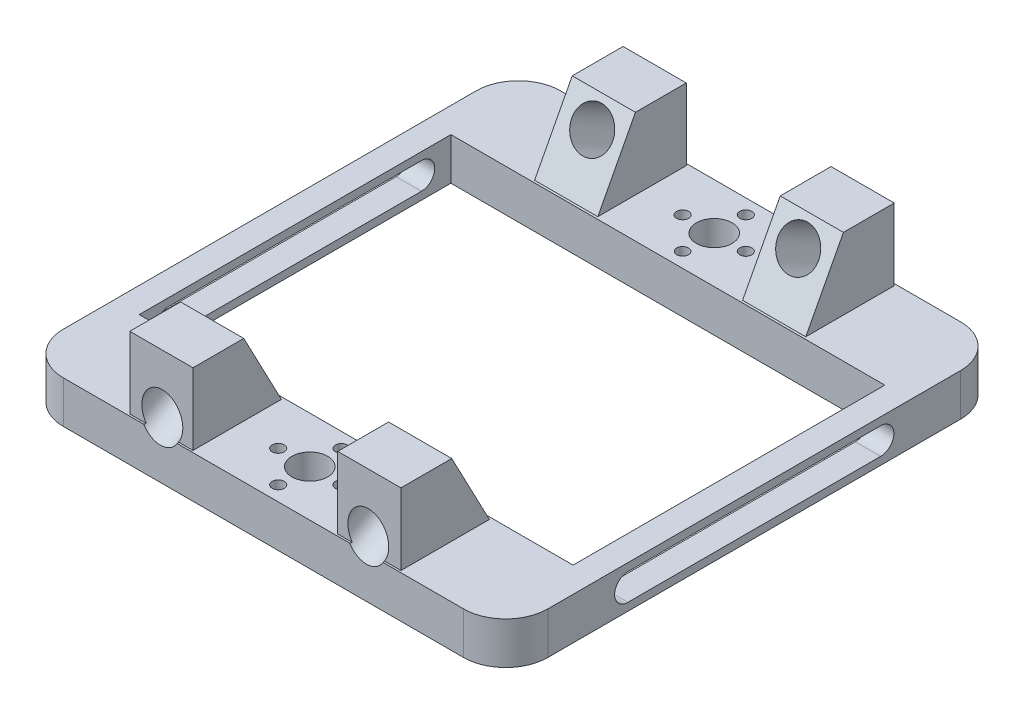
from build123d import *

# Parameters (mm, degrees)
SKETCH2_W               = 115
SKETCH2_H               = 22
SKETCH2_R               = 4.25
BOSS_EXTRUDE1_DEPTH     = 10
BOSS_EXTRUDE1_2_DEPTH   = 10
SKETCH3_R               = 1.4
SKETCH3_R_2             = 1.44
CUT_EXTRUDE3_DEPTH      = 83.989457162
FILLET1_R               = 10
FILLET2_R               = 10
SKETCH5_W               = 6
SKETCH5_H               = 10
BOSS_EXTRUDE2_DEPTH     = 74
CUT_EXTRUDE4_DEPTH      = 125.346290656
CUT_EXTRUDE4_DEPTH_BACK = 125.346290656
SKETCH7_W               = 15
SKETCH7_H               = 21
BOSS_EXTRUDE3_DEPTH     = 17
CUT_EXTRUDE5_DEPTH      = 99.933743619
SKETCH9_R               = 4.85
CUT_EXTRUDE6_DEPTH      = 110.718166224
MIRROR5_COPY_1_SKETCH_W = 15
MIRROR5_COPY_1_SKETCH_H = 21
MIRROR5_COPY_1_DEPTH    = 17
MIRROR5_COPY_2_DEPTH    = 99.933743619
MIRROR5_COPY_3_SKETCH_R = 4.85
MIRROR5_COPY_3_DEPTH    = 110.718166224


with BuildPart() as part:
    # Sketch2 → Boss-Extrude1 (new body)
    with BuildSketch(Plane(origin=(0, 0, 0), x_dir=(1, 0, 0), z_dir=(0, 1, 0))):
        with Locations((0, -48)):
            Rectangle(SKETCH2_W, SKETCH2_H)
        with Locations(Location((0, -48, 0), (0, 0, 270))):
            Circle(SKETCH2_R, mode=Mode.SUBTRACT)
    extrude(amount=BOSS_EXTRUDE1_DEPTH)


with BuildPart() as body_2:
    # Sketch2 → Boss-Extrude1 2 (new body)
    with BuildSketch(Plane(origin=(0, 0, 0), x_dir=(1, 0, 0), z_dir=(0, 1, 0))):
        with Locations((0, 48)):
            Rectangle(SKETCH2_W, SKETCH2_H)
        with Locations(Location((0, 48, 0), (0, 0, 270))):
            Circle(SKETCH2_R, mode=Mode.SUBTRACT)
    extrude(amount=BOSS_EXTRUDE1_2_DEPTH)


with BuildPart() as cut_extrude3_tool:
    # Sketch3 → Cut-Extrude3 (new, through all)
    with BuildSketch(Plane(origin=(0, 10, 0), x_dir=(1, 0, 0), z_dir=(0, 1, 0))):
        with Locations(Location((0, -40.5, 0), (0, 0, 270))):
            Circle(SKETCH3_R)
        with Locations(Location((0, -55.5, 0), (0, 0, 270))):
            Circle(SKETCH3_R_2)
        with Locations(Location((7.5, -48, 0), (0, 0, 270))):
            Circle(SKETCH3_R_2)
        with Locations(Location((-7.5, -48, 0), (0, 0, 270))):
            Circle(SKETCH3_R_2)
        with Locations(Location((-7.5, 48, 0), (0, 0, 90))):
            Circle(SKETCH3_R_2)
        with Locations(Location((7.5, 48, 0), (0, 0, 90))):
            Circle(SKETCH3_R_2)
        with Locations(Location((0, 55.5, 0), (0, 0, 90))):
            Circle(SKETCH3_R_2)
        with Locations(Location((0, 40.5, 0), (0, 0, 90))):
            Circle(SKETCH3_R)
    extrude(amount=-CUT_EXTRUDE3_DEPTH)


with BuildPart() as part_1:
    add(part.part)

    # Cut-Extrude3: cut by cut_extrude3_tool
    add(cut_extrude3_tool.part, mode=Mode.SUBTRACT)

    # Fillet2
    fillet2_edges = [part_1.edges().sort_by_distance(p)[0] for p in [
        (57.5, 5, 59),
        (-57.5, 5, 59),
    ]]
    fillet(fillet2_edges, radius=FILLET2_R)



with BuildPart() as body_2_1:
    add(body_2.part)

    # Cut-Extrude3: cut by cut_extrude3_tool
    add(cut_extrude3_tool.part, mode=Mode.SUBTRACT)

    # Fillet1
    fillet1_edges = [body_2_1.edges().sort_by_distance(p)[0] for p in [
        (-57.5, 5, -59),
        (57.5, 5, -59),
    ]]
    fillet(fillet1_edges, radius=FILLET1_R)


with BuildPart() as part_2:
    add(part_1.part)

    add(body_2_1.part)  # Boss-Extrude2 merges body 2
    # Sketch5 → Boss-Extrude2 (add)
    with BuildSketch(Plane(origin=(0, 0, 37), x_dir=(-1, 0, 0), z_dir=(0, 0, -1))):
        with Locations((-54.5, 5)):
            Rectangle(SKETCH5_W, SKETCH5_H)
    boss_extrude2 = extrude(amount=BOSS_EXTRUDE2_DEPTH)

    # Mirror3: Boss-Extrude2 across plane
    add(boss_extrude2.mirror(Plane(origin=(0, 0, 0), x_dir=(0, 0, 1), z_dir=(1, 0, 0))))

    # Sketch6 → Cut-Extrude4 (cut, two sides: drawn at the far end of the back side and taken through both)
    with BuildSketch(Plane(origin=(-51.5, 0, 0), x_dir=(0, 0, -1), z_dir=(1, 0, 0)).offset(-CUT_EXTRUDE4_DEPTH_BACK)):
        with BuildLine():
            Line((-30, 8.15), (30, 8.15))
            ThreePointArc((30, 8.15), (33.15, 5), (30, 1.85))
            Line((30, 1.85), (-30, 1.85))
            ThreePointArc((-30, 1.85), (-33.15, 5), (-30, 8.15))
        make_face()
    extrude(amount=CUT_EXTRUDE4_DEPTH + CUT_EXTRUDE4_DEPTH_BACK, mode=Mode.SUBTRACT)

    # Sketch7 → Boss-Extrude3 (add)
    with BuildSketch(Plane(origin=(0, 10, 0), x_dir=(1, 0, 0), z_dir=(0, 1, 0))):
        with Locations((-24.685243699, -48.050972885)):
            Rectangle(SKETCH7_W, SKETCH7_H)
    boss_extrude3 = extrude(amount=BOSS_EXTRUDE3_DEPTH)

    # Sketch8 → Cut-Extrude5 (cut, through all)
    with BuildSketch(Plane(origin=(-17.185243699, 0, 0), x_dir=(0, 0, -1), z_dir=(1, 0, 0))):
        Polygon((-37.550972885, 10), (-46.484101226, 27), (-37.550972885, 27), align=None)
    cut_extrude5 = extrude(amount=-CUT_EXTRUDE5_DEPTH, mode=Mode.SUBTRACT)

    # Sketch9 → Cut-Extrude6 (cut, through all)
    with BuildSketch(Plane(origin=(0, -13.298785258, 25.307970597), x_dir=(-1, 0, 0), z_dir=(0, 0.46516567138991105, -0.8852236430193069))):
        with Locations(Location((24.447463247, 39.085922225, 0), (0, 0, 90))):
            Circle(SKETCH9_R)
    cut_extrude6 = extrude(amount=-CUT_EXTRUDE6_DEPTH, mode=Mode.SUBTRACT)

    # Mirror4: Boss-Extrude3, Cut-Extrude5, Cut-Extrude6 across plane
    add(boss_extrude3.mirror(Plane(origin=(0, 0, 0), x_dir=(0, 0, 1), z_dir=(1, 0, 0))))
    add(cut_extrude5.mirror(Plane(origin=(0, 0, 0), x_dir=(0, 0, 1), z_dir=(1, 0, 0))), mode=Mode.SUBTRACT)
    add(cut_extrude6.mirror(Plane(origin=(0, 0, 0), x_dir=(0, 0, 1), z_dir=(1, 0, 0))), mode=Mode.SUBTRACT)

    # Mirror5: Boss-Extrude3, Cut-Extrude5, Cut-Extrude6 across plane
    add(boss_extrude3.mirror(Plane.XY))
    add(cut_extrude5.mirror(Plane.XY), mode=Mode.SUBTRACT)
    add(cut_extrude6.mirror(Plane.XY), mode=Mode.SUBTRACT)

    # Mirror5 copy 1 sketch → Mirror5 copy 1 (add)
    with BuildSketch(Plane(origin=(0, 10, 0), x_dir=(-1, 0, 0), z_dir=(0, 1, 0))):
        with Locations((-24.685243699, -48.050972885)):
            Rectangle(MIRROR5_COPY_1_SKETCH_W, MIRROR5_COPY_1_SKETCH_H)
    extrude(amount=MIRROR5_COPY_1_DEPTH)

    # Mirror5 copy 2 sketch → Mirror5 copy 2 (cut, through all)
    with BuildSketch(Plane.ZY.offset(-17.185243699)):
        Polygon((-37.550972885, 10), (-46.484101226, 27), (-37.550972885, 27), align=None)
    extrude(amount=-MIRROR5_COPY_2_DEPTH, mode=Mode.SUBTRACT)

    # Mirror5 copy 3 sketch → Mirror5 copy 3 (cut, through all)
    with BuildSketch(Plane(origin=(0, -13.298785258, -25.307970597), x_dir=(1, 0, 0), z_dir=(0, 0.46516567138991105, 0.8852236430193069))):
        with Locations(Location((24.447463247, 39.085922225, 0), (0, 0, 90))):
            Circle(MIRROR5_COPY_3_SKETCH_R)
    extrude(amount=-MIRROR5_COPY_3_DEPTH, mode=Mode.SUBTRACT)


solid = part_2.part
